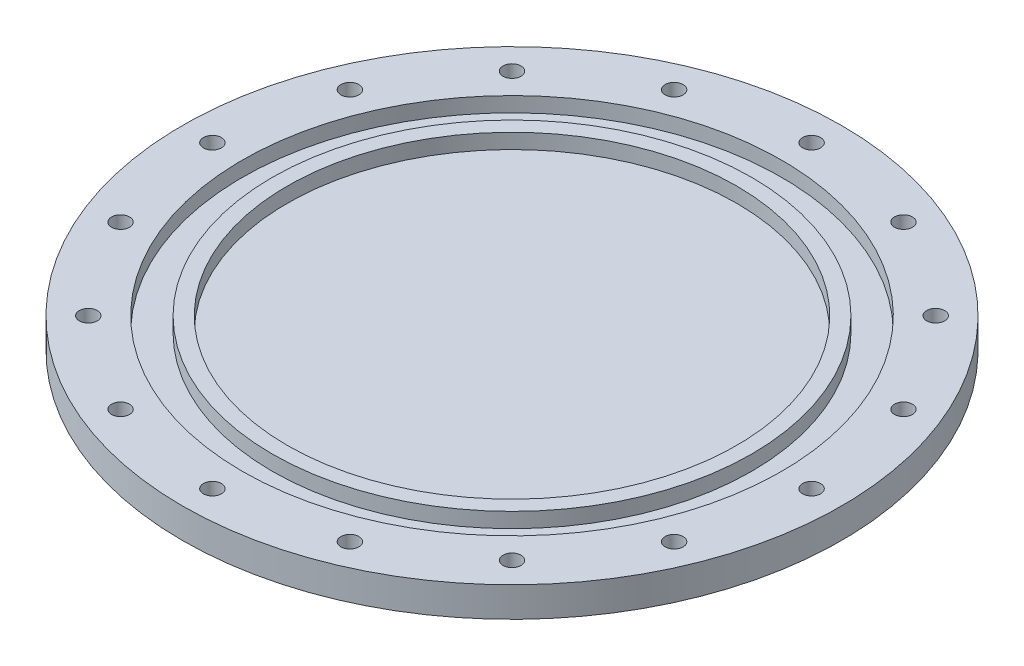
from build123d import *

# Parameters (mm, degrees)
SKETCH_1_R        = 80
SKETCH_1_R_2      = 75
EXTRUDE_1_DEPTH   = 10
SKETCH_1_R_3      = 110
SKETCH_1_R_4      = 3
SKETCH_1_R_5      = 90
EXTRUDE_1_2_DEPTH = 10
SKETCH_1_3_R      = 90
SKETCH_1_3_R_2    = 80
SKETCH_1_3_R_3    = 75
EXTRUDE_2_DEPTH   = 5


with BuildPart() as part:
    # 草图1 → 凸台-拉伸1 (new body)
    with BuildSketch(Plane(origin=(0, 0, 0), x_dir=(1, 0, 0), z_dir=(0, 1, 0))):
        Circle(SKETCH_1_R)
        Circle(SKETCH_1_R_2, mode=Mode.SUBTRACT)
    extrude(amount=EXTRUDE_1_DEPTH)



with BuildPart() as body_2:
    # 草图1 → Extrude 1 2 (new body)
    with BuildSketch(Plane(origin=(0, 0, 0), x_dir=(1, 0, 0), z_dir=(0, 1, 0))):
        Circle(SKETCH_1_R_3)
        with Locations((-70.710678119, -70.710678119)):
            Circle(SKETCH_1_R_4, mode=Mode.SUBTRACT)
        with Locations((-38.268343237, -92.387953251)):
            Circle(SKETCH_1_R_4, mode=Mode.SUBTRACT)
        with Locations((-92.387953251, -38.268343237)):
            Circle(SKETCH_1_R_4, mode=Mode.SUBTRACT)
        with Locations((-100, 0)):
            Circle(SKETCH_1_R_4, mode=Mode.SUBTRACT)
        with Locations((0, -100)):
            Circle(SKETCH_1_R_4, mode=Mode.SUBTRACT)
        with Locations((38.268343237, -92.387953251)):
            Circle(SKETCH_1_R_4, mode=Mode.SUBTRACT)
        with Locations((70.710678119, -70.710678119)):
            Circle(SKETCH_1_R_4, mode=Mode.SUBTRACT)
        with Locations((92.387953251, -38.268343237)):
            Circle(SKETCH_1_R_4, mode=Mode.SUBTRACT)
        with Locations((-92.387953251, 38.268343237)):
            Circle(SKETCH_1_R_4, mode=Mode.SUBTRACT)
        with Locations((-70.710678119, 70.710678119)):
            Circle(SKETCH_1_R_4, mode=Mode.SUBTRACT)
        with Locations((-38.268343237, 92.387953251)):
            Circle(SKETCH_1_R_4, mode=Mode.SUBTRACT)
        Circle(SKETCH_1_R_5, mode=Mode.SUBTRACT)
        with Locations((100, 0)):
            Circle(SKETCH_1_R_4, mode=Mode.SUBTRACT)
        with Locations((92.387953251, 38.268343237)):
            Circle(SKETCH_1_R_4, mode=Mode.SUBTRACT)
        with Locations((0, 100)):
            Circle(SKETCH_1_R_4, mode=Mode.SUBTRACT)
        with Locations((38.268343237, 92.387953251)):
            Circle(SKETCH_1_R_4, mode=Mode.SUBTRACT)
        with Locations((70.710678119, 70.710678119)):
            Circle(SKETCH_1_R_4, mode=Mode.SUBTRACT)
    extrude(amount=EXTRUDE_1_2_DEPTH)


with BuildPart() as part_1:
    add(part.part)

    add(body_2.part)  # 凸台-拉伸2 merges body 2
    # 草图1<3> → 凸台-拉伸2 (add)
    # profile 1 of 2: a face of its own
    with BuildSketch(Plane(origin=(0, 0, 0), x_dir=(1, 0, 0), z_dir=(0, 1, 0))):
        Circle(SKETCH_1_3_R)
        Circle(SKETCH_1_3_R_2, mode=Mode.SUBTRACT)
    # profile 2 of 2: a face of its own
    with BuildSketch(Plane(origin=(0, 0, 0), x_dir=(1, 0, 0), z_dir=(0, 1, 0))):
        Circle(SKETCH_1_3_R_3)
    extrude(amount=EXTRUDE_2_DEPTH)


solid = part_1.part
